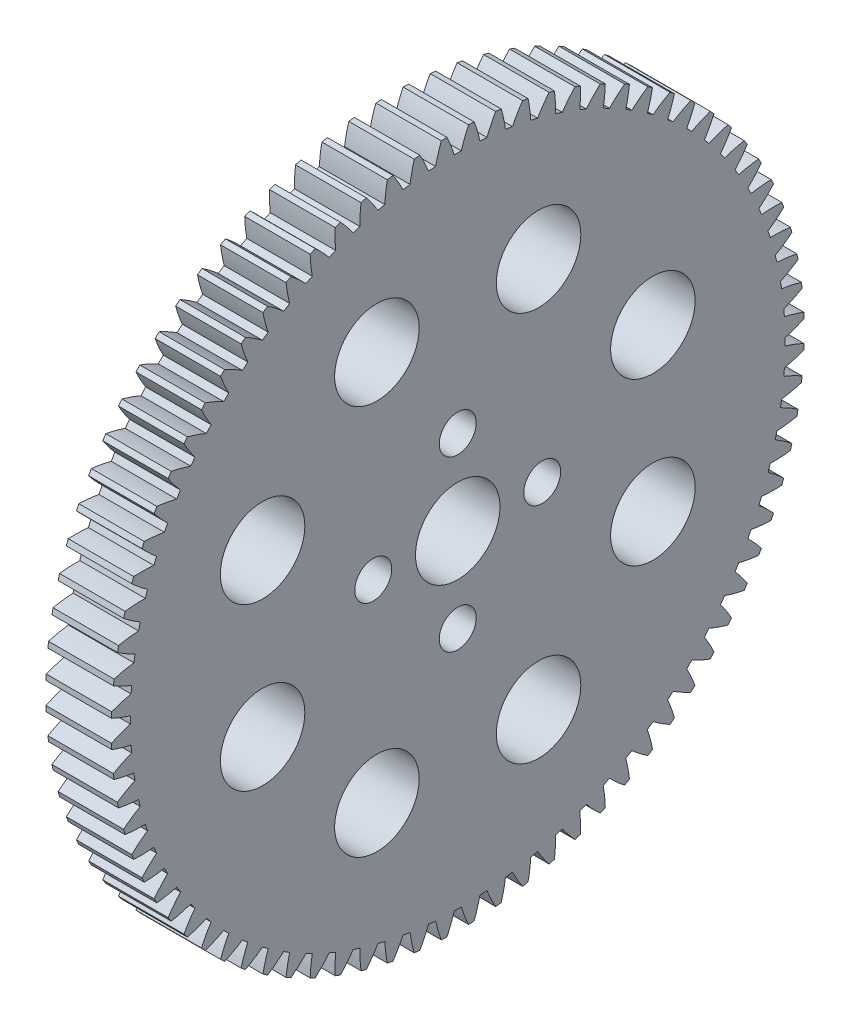
from build123d import *

# Parameters (mm, degrees)
BASPROSKE_W        = 6.2
BASPROSKE_H        = 32.8
TOOTHCUT_DEPTH     = 47.798717931
TEETHCUTS_COUNT    = 80
TEETHCUTS_ANGLE    = 355.5
BORSKE_R           = 4
BORE_DEPTH         = 50.0000508
SKETCH1_R          = 4
SKETCH1_R_2        = 1.75
CUT_EXTRUDE1_DEPTH = 47.776337838


with BuildPart() as part:
    # BasProSke → Base-Revolve (revolve)
    with BuildSketch(Plane(origin=(0, 0, 0), x_dir=(1, 0, 0), z_dir=(0, 1, 0)), mode=Mode.PRIVATE) as base_revolve_sk:
        with Locations((3.1, 16.4)):
            Rectangle(BASPROSKE_W, BASPROSKE_H)
    revolve(base_revolve_sk.sketch.rotate(Axis((-10, 0, 0), (1, 0, 0)), 180), axis=Axis((-10, 0, 0), (1, 0, 0)))

    # TooCutSke → ToothCut (cut, through all)
    with BuildSketch(Plane(origin=(0, 0, 0), x_dir=(0, 0, -1), z_dir=(1, 0, 0))):
        with BuildLine():
            ThreePointArc((0.335706178, 30.997182168), (0, 30.999), (-0.335706178, 30.997182168))
            ThreePointArc((-0.335706178, 30.997182168), (-0.651023397, 31.916413715), (-1.035171918, 32.809073505))
            ThreePointArc((-1.035171918, 32.809073505), (0, 32.8254), (1.035171918, 32.809073505))
            ThreePointArc((1.035171918, 32.809073505), (0.651023397, 31.916413715), (0.335706178, 30.997182168))
        make_face()
    toothcut = extrude(amount=TOOTHCUT_DEPTH, mode=Mode.SUBTRACT)

    # TeethCuts: ToothCut ×80 about axis
    teethcuts_axis = Axis((-10, 0, 0), (1, 0, 0))
    for i in range(1, TEETHCUTS_COUNT):
        add(toothcut.rotate(teethcuts_axis, i * TEETHCUTS_ANGLE / (TEETHCUTS_COUNT - 1)), mode=Mode.SUBTRACT)

    # BorSke → Bore (cut, symmetric)
    with BuildSketch(Plane(origin=(0, 0, 0), x_dir=(0, 0, -1), z_dir=(1, 0, 0))):
        with Locations(Location((0, 0, 0), (0, 0, 180))):
            Circle(BORSKE_R)
    extrude(amount=BORE_DEPTH, both=True, mode=Mode.SUBTRACT)

    # Sketch1 → Cut-Extrude1 (cut, through all)
    with BuildSketch(Plane(origin=(6.2, 0, 0), x_dir=(0, 0, -1), z_dir=(1, 0, 0))):
        with Locations((-7.653668647, 18.47759065)):
            Circle(SKETCH1_R)
        with Locations((7.653668647, -18.47759065)):
            Circle(SKETCH1_R)
        with Locations((18.47759065, 7.653668647)):
            Circle(SKETCH1_R)
        with Locations((-18.47759065, -7.653668647)):
            Circle(SKETCH1_R)
        with Locations((7.653668647, 18.47759065)):
            Circle(SKETCH1_R)
        with Locations((18.47759065, -7.653668647)):
            Circle(SKETCH1_R)
        with Locations((-7.653668647, -18.47759065)):
            Circle(SKETCH1_R)
        with Locations((-18.47759065, 7.653668647)):
            Circle(SKETCH1_R)
        with Locations((0, 8)):
            Circle(SKETCH1_R_2)
        with Locations((0, -8)):
            Circle(SKETCH1_R_2)
        with Locations((8, 0)):
            Circle(SKETCH1_R_2)
        with Locations((-8, 0)):
            Circle(SKETCH1_R_2)
    extrude(amount=-CUT_EXTRUDE1_DEPTH, mode=Mode.SUBTRACT)


solid = part.part
